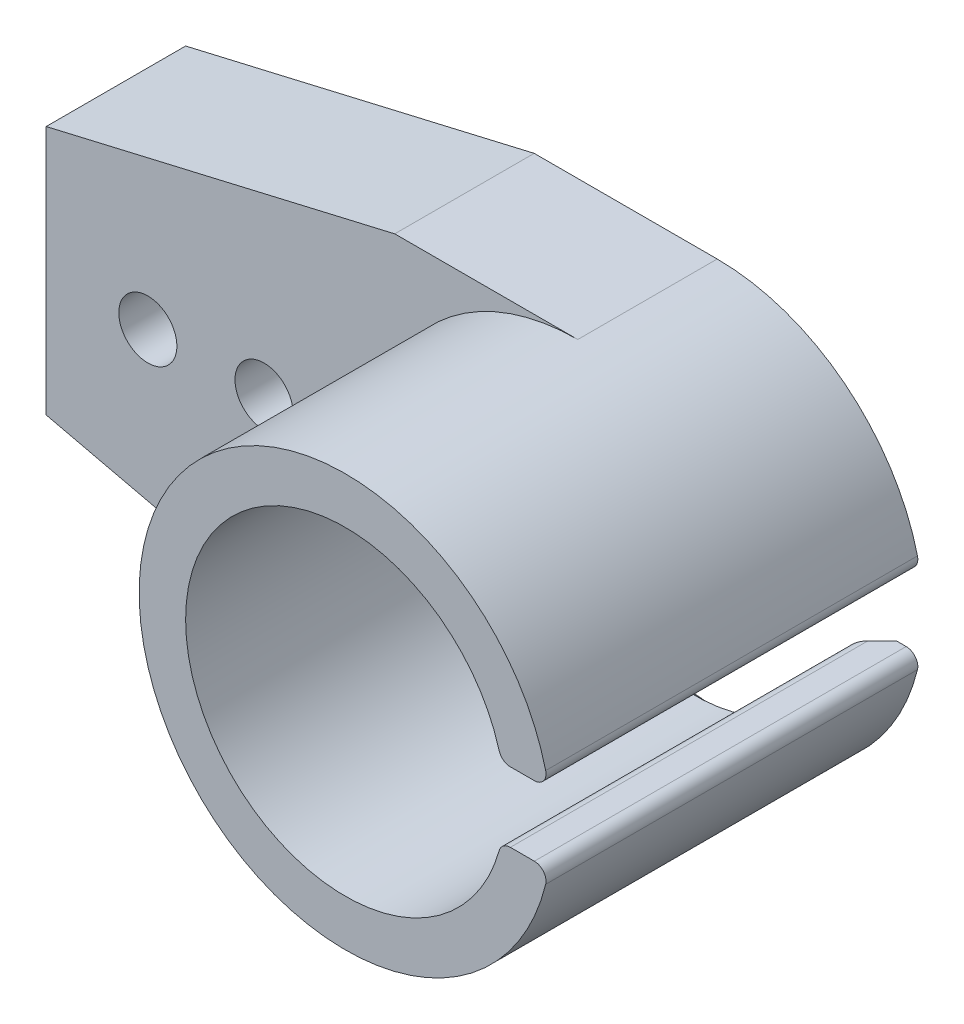
from build123d import *
from build123d.topology import SkipClean

# Parameters (mm, degrees)
ESQUISSE1_R             = 2.5
BOSS_EXTRU_1_DEPTH      = 32
CHANFREIN1_SIZE         = 2
CONG_2_R                = 1
ENL_V_MAT_EXTRU_1_DEPTH = 2
ENL_V_START             = -20
ENL_V_MAT_EXTRU_2_DEPTH = 20
ENL_V_MAT_EXTRU_3_DEPTH = 53.991744678


with BuildPart() as part:
    # Esquisse1 → Boss.-Extru.1 (new body)
    with BuildSketch(Plane.XY):
        with BuildLine():
            Line((13.4187369, 3), (17.494642037, 3))
            ThreePointArc((17.494642037, 3), (11.441426921, 13.570418195), (0, 17.75))
            Line((0, 17.75), (-45.75, 17.75))
            Line((-45.75, 17.75), (-45.75, -17.75))
            Line((-45.75, -17.75), (0, -17.75))
            ThreePointArc((0, -17.75), (11.441426921, -13.570418195), (17.494642037, -3))
            Line((17.494642037, -3), (13.4187369, -3))
            ThreePointArc((13.4187369, -3), (-13.75, 0), (13.4187369, 3))
        make_face()
        with Locations((-37, 0)):
            Circle(ESQUISSE1_R, mode=Mode.SUBTRACT)
        with Locations((-27, 0)):
            Circle(ESQUISSE1_R, mode=Mode.SUBTRACT)
    extrude(amount=BOSS_EXTRU_1_DEPTH)

    # Chanfrein1
    chanfrein1_edges = [part.edges().sort_by_distance(p)[0] for p in [
        (-13.75, 0, 0),
    ]]
    chamfer(chanfrein1_edges, length=CHANFREIN1_SIZE)

    # Congé2
    cong_2_edges = [part.edges().sort_by_distance(p)[0] for p in [
        (17.494642037, -3, 16),
        (17.494642037, 3, 16),
        (13.4187369, -3, 17),
        (13.4187369, 3, 17),
    ]]
    fillet(cong_2_edges, radius=CONG_2_R)

    # Esquisse2 → Enlèv. mat.-Extru.1 (cut)
    with BuildSketch(Plane(origin=(0, 0, 0), x_dir=(-1, 0, 0), z_dir=(0, 0, -1))):
        with BuildLine():
            Line((45.75, 10.1), (27, 10.1))
            ThreePointArc((27, 10.1), (16.9, 0), (27, -10.1))
            Line((27, -10.1), (45.75, -10.1))
            Line((45.75, -10.1), (45.75, 10.1))
        make_face()
    extrude(amount=-ENL_V_MAT_EXTRU_1_DEPTH, mode=Mode.SUBTRACT)

    # Esquisse3 → Enlèv. mat.-Extru.2 (cut)
    with SkipClean():  # the faces are left unmerged after this step: merging them gives an invalid solid
        with BuildSketch(Plane.XY.offset(32).offset(ENL_V_START)):
            with BuildLine():
                Line((0, 17.75), (-45.75, 17.75))
                Line((-45.75, 17.75), (-45.75, -17.75))
                Line((-45.75, -17.75), (0, -17.75))
                ThreePointArc((0, -17.75), (-17.75, 0), (0, 17.75))
            make_face()
        extrude(amount=ENL_V_MAT_EXTRU_2_DEPTH, mode=Mode.SUBTRACT)

    # Esquisse5 → Enlèv. mat.-Extru.3 (cut, through all)
    with SkipClean():  # the faces are left unmerged after this step: merging them gives an invalid solid
        with BuildSketch(Plane.XY.offset(12)):
            Polygon((-15.75, 17.75), (-45.75, 10.75), (-45.75, 17.75), align=None)
            Polygon((-45.75, -17.75), (-15.75, -17.75), (-45.75, -10.75), align=None)
        extrude(amount=-ENL_V_MAT_EXTRU_3_DEPTH, mode=Mode.SUBTRACT)


solid = part.part
